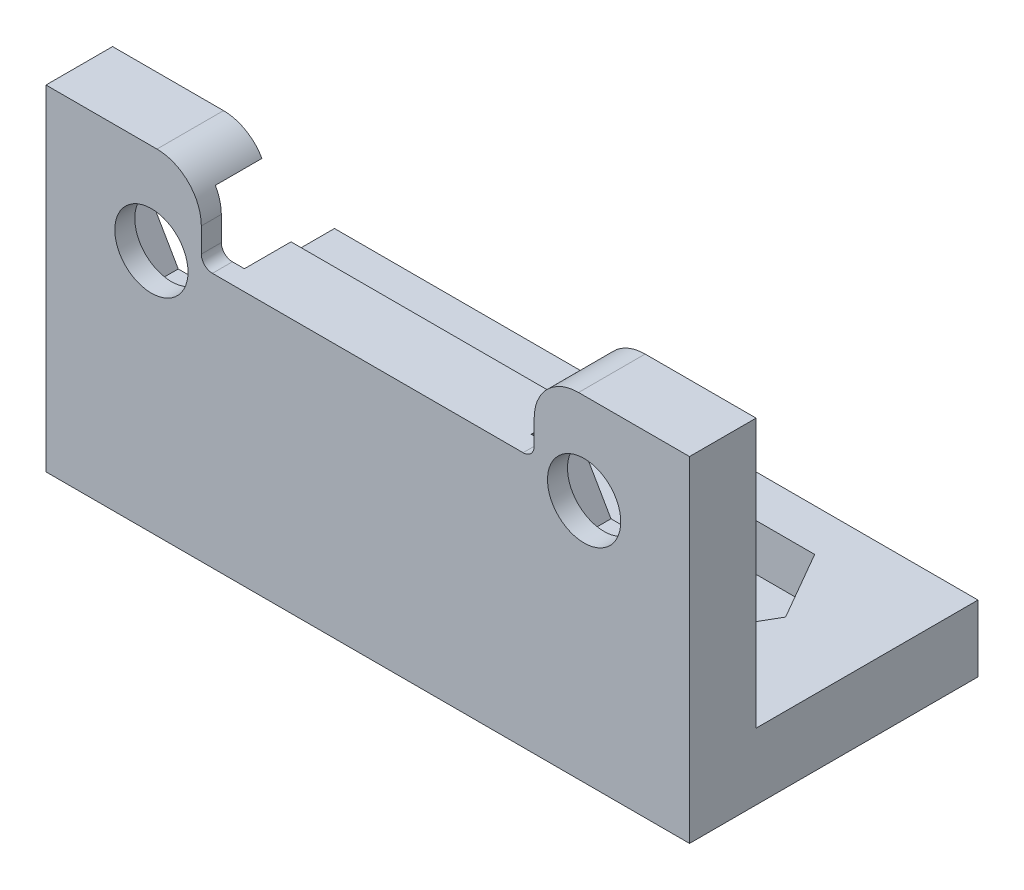
from build123d import *

# Parameters (mm, degrees)
SKETCH1_R           = 1.65
BOSS_EXTRUDE1_DEPTH = 3
SKETCH1_3_R         = 1.65
CUT_EXTRUDE1_DEPTH  = 2.1
FILLET3_R           = 2
SKETCH2_W           = 29
SKETCH2_H           = 2
BOSS_EXTRUDE2_DEPTH = 3
SKETCH2_3_W         = 29
SKETCH2_3_H         = 3
BOSS_EXTRUDE3_DEPTH = 13
SKETCH3_R           = 1.6
CUT_EXTRUDE2_DEPTH  = 33.975900291
SKETCH3_3_R         = 1.6
CUT_EXTRUDE3_DEPTH  = 2.1


with BuildPart() as part:
    # Sketch1 → Boss-Extrude1 (new body)
    with BuildSketch(Plane.XY):
        with BuildLine():
            Line((0, 0), (29, 0))
            Line((29, 0), (29, 10.1))
            Line((29, 10.1), (22, 10.1))
            Line((22, 10.1), (22, 7))
            ThreePointArc((22, 7), (21.853553391, 6.646446609), (21.5, 6.5))
            Line((21.5, 6.5), (7.5, 6.5))
            ThreePointArc((7.5, 6.5), (7.146446609, 6.646446609), (7, 7))
            Line((7, 7), (7, 10.1))
            Line((7, 10.1), (0, 10.1))
            Line((0, 10.1), (0, 0))
        make_face()
        with Locations((4.75, 6)):
            Circle(SKETCH1_R, mode=Mode.SUBTRACT)
        with Locations((24.25, 6)):
            Circle(SKETCH1_R, mode=Mode.SUBTRACT)
    extrude(amount=BOSS_EXTRUDE1_DEPTH)

    # Sketch1<3> → Cut-Extrude1 (cut)
    # profile 1 of 2: a face of its own
    with BuildSketch(Plane.XY):
        with BuildLine():
            Line((2.960214166, 9.1), (1.170428331, 6))
            Line((1.170428331, 6), (2.960214166, 2.9))
            Line((2.960214166, 2.9), (6.539785834, 2.9))
            Line((6.539785834, 2.9), (8.329571669, 6))
            Line((8.329571669, 6), (8.040896534, 6.5))
            Line((8.040896534, 6.5), (7.5, 6.5))
            ThreePointArc((7.5, 6.5), (7.146446609, 6.646446609), (7, 7))
            Line((7, 7), (7, 9.1))
            Line((7, 9.1), (2.960214166, 9.1))
        make_face()
        with Locations((4.75, 6)):
            Circle(SKETCH1_3_R, mode=Mode.SUBTRACT)
    # profile 2 of 2: a face of its own
    with BuildSketch(Plane.XY):
        with BuildLine():
            Line((27.829571669, 6), (26.039785834, 9.1))
            Line((26.039785834, 9.1), (22, 9.1))
            Line((22, 9.1), (22, 7))
            ThreePointArc((22, 7), (21.853553391, 6.646446609), (21.5, 6.5))
            Line((21.5, 6.5), (20.959103466, 6.5))
            Line((20.959103466, 6.5), (20.670428331, 6))
            Line((20.670428331, 6), (22.460214166, 2.9))
            Line((22.460214166, 2.9), (26.039785834, 2.9))
            Line((26.039785834, 2.9), (27.829571669, 6))
        make_face()
        with Locations((24.25, 6)):
            Circle(SKETCH1_3_R, mode=Mode.SUBTRACT)
    extrude(amount=CUT_EXTRUDE1_DEPTH, mode=Mode.SUBTRACT)

    # Fillet3
    fillet3_edges = [part.edges().sort_by_distance(p)[0] for p in [
        (7, 10.1, 1.5),
        (22, 10.1, 1.5),
    ]]
    fillet(fillet3_edges, radius=FILLET3_R)

    # Sketch2 → Boss-Extrude2 (add)
    with BuildSketch(Plane.XY.offset(3)):
        with Locations((14.5, -1)):
            Rectangle(SKETCH2_W, SKETCH2_H)
    extrude(amount=-BOSS_EXTRUDE2_DEPTH)

    # Sketch2<3> → Boss-Extrude3 (add)
    with BuildSketch(Plane.XY.offset(3)):
        with Locations((14.5, -3.5)):
            Rectangle(SKETCH2_3_W, SKETCH2_3_H)
    extrude(amount=-BOSS_EXTRUDE3_DEPTH)

    # Sketch3 → Cut-Extrude2 (cut, through all)
    with BuildSketch(Plane(origin=(0, -2, 0), x_dir=(1, 0, 0), z_dir=(0, 1, 0))):
        with Locations((21.75, 5)):
            Circle(SKETCH3_R)
        with Locations((7.25, 5)):
            Circle(SKETCH3_R)
    extrude(amount=-CUT_EXTRUDE2_DEPTH, mode=Mode.SUBTRACT)

    # Sketch3<3> → Cut-Extrude3 (cut)
    # profile 1 of 2: a face of its own
    with BuildSketch(Plane(origin=(0, -2, 0), x_dir=(1, 0, 0), z_dir=(0, 1, 0))):
        Polygon((23.539785834, 1.9), (25.329571669, 5), (23.539785834, 8.1), (19.960214166, 8.1), (18.170428331, 5), (19.960214166, 1.9), align=None)
        with Locations((21.75, 5)):
            Circle(SKETCH3_3_R, mode=Mode.SUBTRACT)
    # profile 2 of 2: a face of its own
    with BuildSketch(Plane(origin=(0, -2, 0), x_dir=(1, 0, 0), z_dir=(0, 1, 0))):
        Polygon((9.039785834, 1.9), (10.829571669, 5), (9.039785834, 8.1), (5.460214166, 8.1), (3.670428331, 5), (5.460214166, 1.9), align=None)
        with Locations((7.25, 5)):
            Circle(SKETCH3_3_R, mode=Mode.SUBTRACT)
    extrude(amount=-CUT_EXTRUDE3_DEPTH, mode=Mode.SUBTRACT)


solid = part.part
